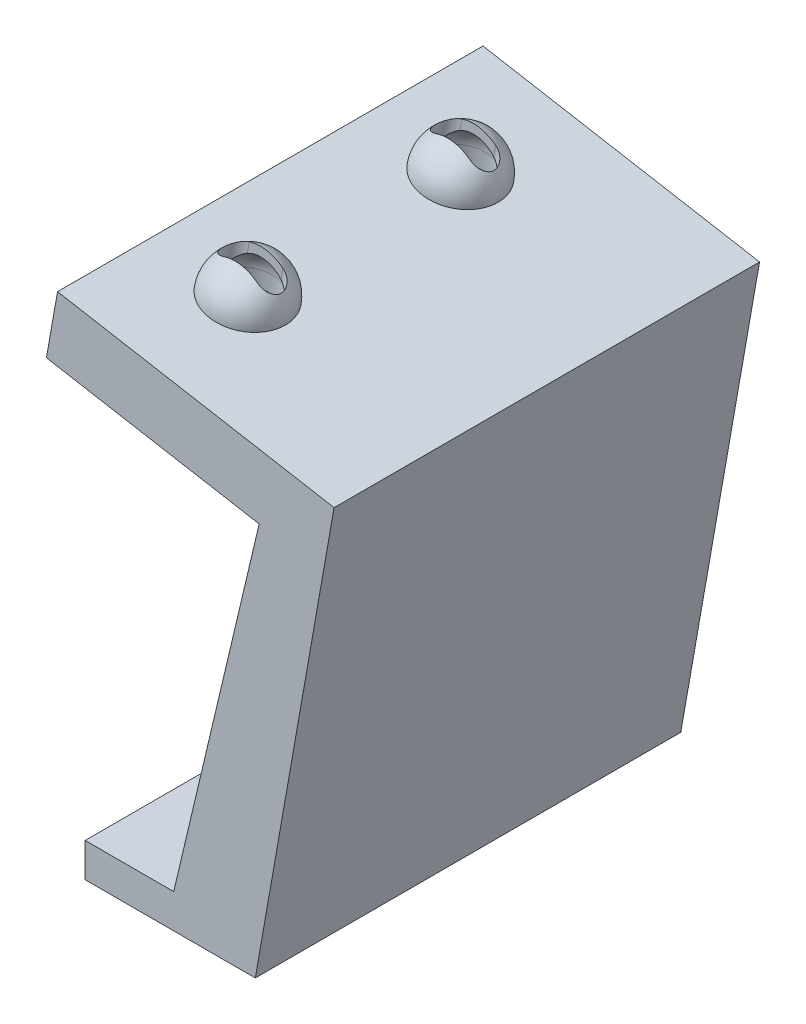
from build123d import *

# Parameters (mm, degrees)
BOSS_EXTRUDE1_DEPTH     = 100
CUT_EXTRUDE1_REACH      = 157.271
CUT_EXTRUDE1_END_RADIUS = 13
SKETCH8_R               = 7
CUT_EXTRUDE2_REACH      = 157.271
CUT_EXTRUDE2_END_RADIUS = 8.996773203
CUT_EXTRUDE3_REACH      = 158.006
SKETCH10_R              = 3.5
BOSS_EXTRUDE2_DEPTH     = 10
BOSS_EXTRUDE3_DEPTH     = 10


with BuildPart() as part:
    # Sketch1 → Boss-Extrude1 (new body)
    with BuildSketch(Plane.XY):
        Polygon((19.47184109, 0), (37.986174065, 105), (-27.013825935, 116.461253746), (-29.6185486, 101.689137451), (20.3814514, 92.872788415), (0.296885126, 8), (-20.52815891, 8), (-20.52815891, 0), align=None)
    extrude(amount=BOSS_EXTRUDE1_DEPTH)

    # Sketch2 → Revolve1 (revolve)
    with BuildSketch(Plane.XY.offset(25), mode=Mode.PRIVATE) as revolve1_sk:
        with BuildLine():
            Line((-5.74033663, 121.933797217), (-6.087072658, 119.967359486))
            ThreePointArc((-6.087072658, 119.967359486), (-11.353092214, 118.782785092), (-14.210795963, 114.203734127))
            Line((-14.210795963, 114.203734127), (-16.177351149, 114.550490866))
            ThreePointArc((-16.177351149, 114.550490866), (-12.498411105, 120.418470556), (-5.74033663, 121.933797217))
        make_face()
    revolve1 = revolve(revolve1_sk.sketch.rotate(Axis((-2.813003283, 138.53552961, 25), (-0.173648177666934, -0.9848077530122075, 0)), 180), axis=Axis((-2.813003283, 138.53552961, 25), (-0.173648177666934, -0.9848077530122075, 0)))

    # Sketch6 → Cut-Revolve3 (revolve, cut)
    with BuildSketch(Plane.XY.offset(25)):
        with BuildLine():
            Line((-7.66496723, 111.018674687), (-9.92239354, 98.216173898))
            Line((-9.92239354, 98.216173898), (-22.724894329, 100.473600207))
            ThreePointArc((-22.724894329, 100.473600207), (-17.378887212, 108.865150473), (-7.66496723, 111.018674687))
        make_face()
    cut_revolve3 = revolve(axis=Axis((-4.945616545, 126.440878787, 25), (-0.17364817766693297, -0.9848077530122077, 0)), mode=Mode.SUBTRACT)

    # Cut-Extrude1: up to this sphere (the profile starts outside it)
    cut_extrude1_end = Location((-9.92239354, 98.216173898, 25)) * Sphere(CUT_EXTRUDE1_END_RADIUS, mode=Mode.PRIVATE)
    # Sketch8 → Cut-Extrude1 (cut, up to the surface)
    with BuildSketch(Plane(origin=(19.101480827, 108.32988094, 0), x_dir=(0.9848077530122076, -0.17364817766693366, 0), z_dir=(0.17364817766693366, 0.9848077530122076, 0)), mode=Mode.PRIVATE) as cut_extrude1_sk1:
        with Locations(Location((-26.83, -25, 0), (0, 0, 180.000000003))):
            Circle(SKETCH8_R)
    cut_extrude1_tool1 = extrude(cut_extrude1_sk1.sketch, amount=-CUT_EXTRUDE1_REACH, mode=Mode.PRIVATE) - cut_extrude1_end
    cut_extrude1 = cut_extrude1_tool1.solids().sort_by_distance((-7.320911, 112.988862, 25))[0]
    add(cut_extrude1, mode=Mode.SUBTRACT)

    # Cut-Extrude2: up to this sphere (the profile starts inside it)
    cut_extrude2_end = Location((-7.302609902, 113.073705215, 25)) * Sphere(CUT_EXTRUDE2_END_RADIUS, mode=Mode.PRIVATE)
    # Sketch9 → Cut-Extrude2 (cut, up to the surface)
    with BuildSketch(Plane(origin=(19.101480827, 108.32988094, 0), x_dir=(0.9848077530122076, -0.17364817766693366, 0), z_dir=(0.17364817766693366, 0.9848077530122076, 0)), mode=Mode.PRIVATE) as cut_extrude2_sk1:
        with BuildLine():
            Line((-22.83, -28), (-30.83, -28))
            ThreePointArc((-30.83, -28), (-33.83, -25), (-30.83, -22))
            Line((-30.83, -22), (-22.83, -22))
            ThreePointArc((-22.83, -22), (-19.83, -25), (-22.83, -28))
        make_face()
    cut_extrude2_tool1 = extrude(cut_extrude2_sk1.sketch, amount=CUT_EXTRUDE2_REACH, mode=Mode.PRIVATE) & cut_extrude2_end
    cut_extrude2 = cut_extrude2_tool1.solids().sort_by_distance((-7.320911, 112.988862, 25))[0]
    add(cut_extrude2, mode=Mode.SUBTRACT)

    # Sketch10 → Cut-Extrude3 (cut, up to next)
    with BuildSketch(Plane(origin=(0, 8, 0), x_dir=(1, 0, 0), z_dir=(0, 1, 0)), mode=Mode.PRIVATE) as cut_extrude3_sk1:
        with Locations(Location((-10.52815891, -25, 0), (0, 0, 270))):
            Circle(SKETCH10_R)
    cut_extrude3_tool1 = extrude(cut_extrude3_sk1.sketch, amount=-CUT_EXTRUDE3_REACH, mode=Mode.PRIVATE) & part.part
    cut_extrude3 = cut_extrude3_tool1.solids().sort_by_distance((-10.528159, 8, 25))[0]
    add(cut_extrude3, mode=Mode.SUBTRACT)

    # Mirror1: Revolve1, Cut-Revolve3, Cut-Extrude1, Cut-Extrude2, Cut-Extrude3 across plane
    add(revolve1.mirror(Plane.XY.offset(50)))
    add(cut_revolve3.mirror(Plane.XY.offset(50)), mode=Mode.SUBTRACT)
    add(cut_extrude1.mirror(Plane.XY.offset(50)), mode=Mode.SUBTRACT)
    add(cut_extrude2.mirror(Plane.XY.offset(50)), mode=Mode.SUBTRACT)
    add(cut_extrude3.mirror(Plane.XY.offset(50)), mode=Mode.SUBTRACT)

    # Sketch11 → Boss-Extrude2 (add, symmetric)
    with BuildSketch(Plane.XY.offset(50)):
        Polygon((2.880107249, 95.958747588), (15.648846694, 72.873882174), (20.3814514, 92.872788415), align=None)
    extrude(amount=BOSS_EXTRUDE2_DEPTH, both=True)

    # Sketch12 → Boss-Extrude3 (add, symmetric)
    with BuildSketch(Plane.XY.offset(50)):
        Polygon((5.029748661, 28), (-14.913487994, 8), (0.296885126, 8), align=None)
    extrude(amount=BOSS_EXTRUDE3_DEPTH, both=True)


solid = part.part
